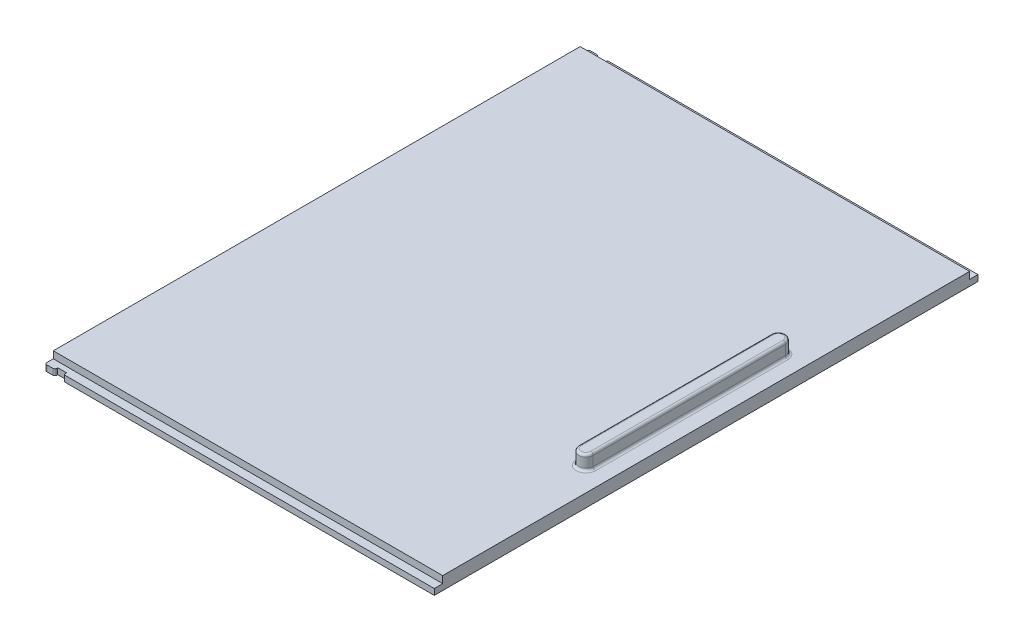
from build123d import *

# Parameters (mm, degrees)
SKETCH1_W           = 81
SKETCH1_H           = 116
BOSS_EXTRUDE1_DEPTH = 3
CUT_EXTRUDE2_DEPTH  = 81
CUT_EXTRUDE3_DEPTH  = 81
SKETCH6_W           = 1.85
SKETCH6_H           = 1.55
CUT_EXTRUDE5_DEPTH  = 0.6
FILLET6_R           = 0.4
CHAMFER2_SIZE       = 0.2
SKETCH7_W           = 1.85
SKETCH7_H           = 1.55
CUT_EXTRUDE6_DEPTH  = 0.6
FILLET7_R           = 0.4
CHAMFER3_SIZE       = 0.2
SKETCH10_W          = 81
SKETCH10_H          = 113.1
CUT_EXTRUDE7_DEPTH  = 0.2
FILLET8_R           = 0.4
BOSS_EXTRUDE2_DEPTH = 3
FILLET10_R          = 0.5
CUT_EXTRUDE8_REACH  = 142.423
SKETCH11_W          = 113.1
SKETCH11_H          = 0.1


with BuildPart() as part:
    # Sketch1 → Boss-Extrude1 (new body)
    with BuildSketch(Plane(origin=(0, 0, 0), x_dir=(1, 0, 0), z_dir=(0, 1, 0))):
        with Locations((40.5, 58)):
            Rectangle(SKETCH1_W, SKETCH1_H)
    extrude(amount=BOSS_EXTRUDE1_DEPTH)

    # Sketch2 → Cut-Extrude2 (cut)
    with BuildSketch(Plane(origin=(81, 0, 0), x_dir=(0, 0, -1), z_dir=(1, 0, 0))):
        Polygon((0, 3), (3, 3), (3, 1.75), (1.25, 1.75), (1.25, 0), (0, 0), align=None)
        Polygon((114.75, 0), (116, 0), (116, 3), (113, 3), (113, 1.75), (114.75, 1.75), align=None)
    extrude(amount=-CUT_EXTRUDE2_DEPTH, mode=Mode.SUBTRACT)

    # Sketch4 → Cut-Extrude3 (cut)
    with BuildSketch(Plane(origin=(81, 0, 0), x_dir=(0, 0, -1), z_dir=(1, 0, 0))):
        Polygon((3.2, 3), (3, 3), (3, 1.75), (1.25, 1.75), (1.25, 0), (1.45, 0), (1.45, 1.55), (3.2, 1.55), align=None)
        Polygon((114.75, 0), (114.55, 0), (114.55, 1.55), (112.8, 1.55), (112.8, 3), (113, 3), (113, 1.75), (114.75, 1.75), align=None)
    extrude(amount=-CUT_EXTRUDE3_DEPTH, mode=Mode.SUBTRACT)

    # Sketch6 → Cut-Extrude5 (cut)
    with BuildSketch(Plane.XY.offset(-1.45)):
        with Locations((3, 0.775)):
            Rectangle(SKETCH6_W, SKETCH6_H)
    extrude(amount=-CUT_EXTRUDE5_DEPTH, mode=Mode.SUBTRACT)

    # Fillet6
    fillet6_edges = [part.edges().sort_by_distance(p)[0] for p in [
        (2.075, 0.775, -1.45),
    ]]
    fillet(fillet6_edges, radius=FILLET6_R)

    # Chamfer2
    chamfer2_edges = [part.edges().sort_by_distance(p)[0] for p in [
        (3.925, 0.775, -1.45),
    ]]
    chamfer(chamfer2_edges, length=CHAMFER2_SIZE)

    # Sketch7 → Cut-Extrude6 (cut)
    with BuildSketch(Plane(origin=(0, 0, -114.55), x_dir=(-1, 0, 0), z_dir=(0, 0, -1))):
        with Locations((-3, 0.775)):
            Rectangle(SKETCH7_W, SKETCH7_H)
    extrude(amount=-CUT_EXTRUDE6_DEPTH, mode=Mode.SUBTRACT)

    # Fillet7
    fillet7_edges = [part.edges().sort_by_distance(p)[0] for p in [
        (2.075, 0.775, -114.55),
    ]]
    fillet(fillet7_edges, radius=FILLET7_R)

    # Chamfer3
    chamfer3_edges = [part.edges().sort_by_distance(p)[0] for p in [
        (3.925, 0.775, -114.55),
    ]]
    chamfer(chamfer3_edges, length=CHAMFER3_SIZE)

    # Sketch10 → Cut-Extrude7 (cut)
    with BuildSketch(Plane(origin=(0, 0, 0), x_dir=(-1, 0, 0), z_dir=(0, -1, 0))):
        with Locations((-40.5, 58)):
            Rectangle(SKETCH10_W, SKETCH10_H)
    extrude(amount=-CUT_EXTRUDE7_DEPTH, mode=Mode.SUBTRACT)

    # Fillet8
    fillet8_edges = [part.edges().sort_by_distance(p)[0] for p in [
        (0, 0.875, -114.55),
        (0, 0.875, -1.45),
    ]]
    fillet(fillet8_edges, radius=FILLET8_R)

    # Sketch9 → Boss-Extrude2 (add)
    with BuildSketch(Plane(origin=(0, 3, 0), x_dir=(1, 0, 0), z_dir=(0, 1, 0))):
        with BuildLine():
            Line((74.5, 38), (74.5, 78))
            ThreePointArc((74.5, 78), (76, 79.5), (77.5, 78))
            Line((77.5, 78), (77.5, 38))
            ThreePointArc((77.5, 38), (76, 36.5), (74.5, 38))
        make_face()
    extrude(amount=BOSS_EXTRUDE2_DEPTH)

    # Fillet10
    fillet10_edges = [part.edges().sort_by_distance(p)[0] for p in [
        (76, 3, -36.5),
        (77.5, 3, -58),
        (76, 3, -79.5),
        (74.5, 3, -58),
        (76, 6, -36.5),
        (77.5, 6, -58),
        (76, 6, -79.5),
        (74.5, 6, -58),
    ]]
    fillet(fillet10_edges, radius=FILLET10_R)

    # Cut-Extrude8: up to this face of the body (flat: up to its plane)
    cut_extrude8_end = Plane(part.part.faces().sort_by_distance((0, 1.591489816, -58))[0])
    # Sketch11 → Cut-Extrude8 (cut, up to the picked face)
    with BuildSketch(Plane(origin=(81, 0, 0), x_dir=(0, 0, -1), z_dir=(1, 0, 0)), mode=Mode.PRIVATE) as cut_extrude8_sk1:
        with Locations((58, 0.25)):
            Rectangle(SKETCH11_W, SKETCH11_H)
    cut_extrude8_tool1 = split(extrude(cut_extrude8_sk1.sketch, amount=-CUT_EXTRUDE8_REACH, mode=Mode.PRIVATE), bisect_by=cut_extrude8_end, keep=Keep.BOTH, mode=Mode.PRIVATE)
    add(cut_extrude8_tool1.solids().sort_by(Axis((81, 0.25, -58), (-1, 0, 0)))[0], mode=Mode.SUBTRACT)


solid = part.part
